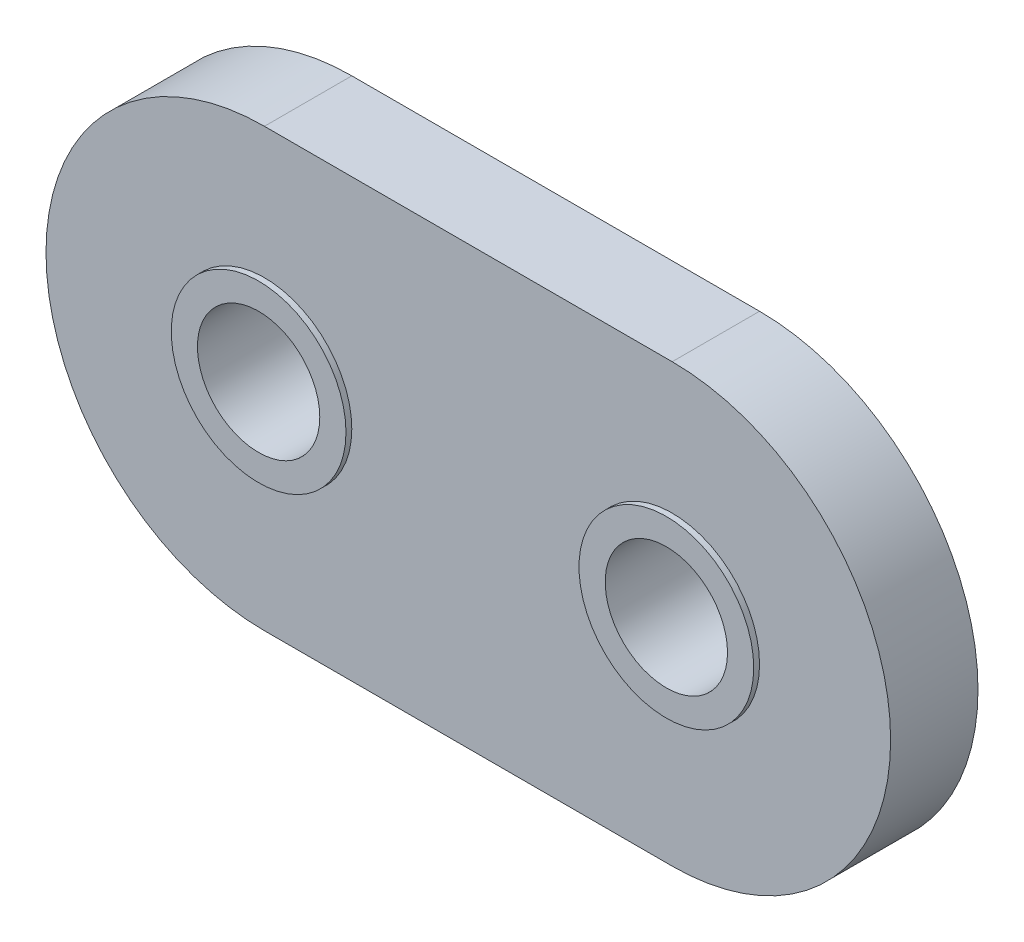
from build123d import *

# Parameters (mm, degrees)
SKETCH_1_R      = 2.1
EXTRUDE_1_DEPTH = 3
SKETCH_2_R      = 3
SKETCH_2_R_2    = 2.1
EXTRUDE_2_DEPTH = 0.2


with BuildPart() as part:
    # 草图1 → 凸台-拉伸1 (new body)
    with BuildSketch(Plane.XY):
        with BuildLine():
            Line((0, 7.5), (14, 7.5))
            ThreePointArc((14, 7.5), (21.5, 0), (14, -7.5))
            Line((14, -7.5), (0, -7.5))
            ThreePointArc((0, -7.5), (-7.5, 0), (0, 7.5))
        make_face()
        Circle(SKETCH_1_R, mode=Mode.SUBTRACT)
        with Locations((14, 0)):
            Circle(SKETCH_1_R, mode=Mode.SUBTRACT)
    extrude(amount=EXTRUDE_1_DEPTH)

    # 草图2 → 凸台-拉伸2 (add)
    # profile 1 of 2: a face of its own
    with BuildSketch(Plane.XY.offset(3)):
        Circle(SKETCH_2_R)
        Circle(SKETCH_2_R_2, mode=Mode.SUBTRACT)
    # profile 2 of 2: a face of its own
    with BuildSketch(Plane.XY.offset(3)):
        with Locations((14, 0)):
            Circle(SKETCH_2_R)
        with Locations((14, 0)):
            Circle(SKETCH_2_R_2, mode=Mode.SUBTRACT)
    extrude(amount=EXTRUDE_2_DEPTH)


solid = part.part
